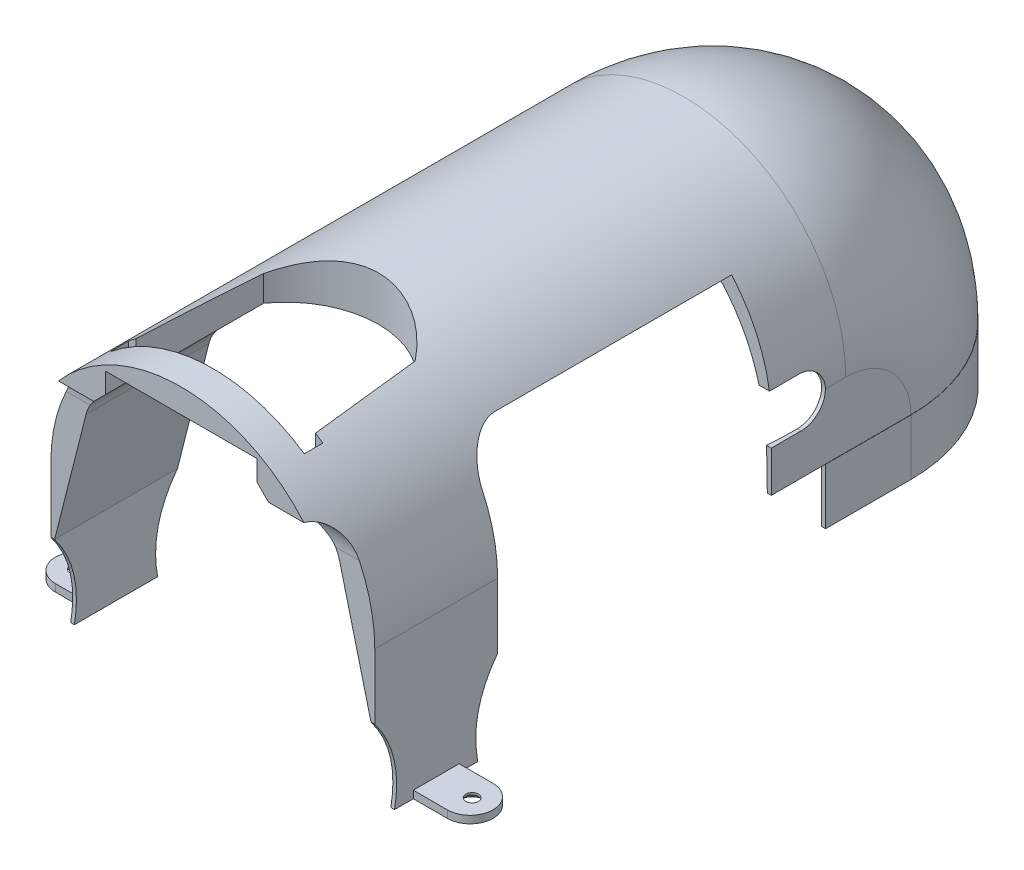
from build123d import *

# Parameters (mm, degrees)
BOSS_EXTRUDE1_DEPTH                                 = 135
CUT_EXTRUDE1_DEPTH                                  = 135
CUT_EXTRUDE2_DEPTH                                  = 121
REVOLVE1_ANGLE                                      = 90
SKETCH8_W                                           = 101.58784839
SKETCH8_H                                           = 201.9517468
CUT_EXTRUDE3_DEPTH                                  = 135
CUT_EXTRUDE4_DEPTH                                  = 64
CUT_EXTRUDE4_DEPTH_BACK                             = 105
CUT_EXTRUDE6_DEPTH                                  = 88
BOSS_EXTRUDE2_DEPTH                                 = 2
CSK_FOR_M3_COUNTERSUNK_FLAT_HEAD_SCREW1_D           = 3.4
CSK_FOR_M3_COUNTERSUNK_FLAT_HEAD_SCREW1_CSINK_D     = 6.3
CSK_FOR_M3_COUNTERSUNK_FLAT_HEAD_SCREW1_CSINK_ANGLE = 90
SKETCH19_W                                          = 40.690948386
SKETCH19_H                                          = 7.539091608
CUT_EXTRUDE7_DEPTH                                  = 77
SKETCH28_W                                          = 94.334032574
SKETCH28_H                                          = 106.25873245
CUT_EXTRUDE10_DEPTH                                 = 79
BOSS_EXTRUDE3_DEPTH                                 = 15


with BuildPart() as part:
    # Sketch1 → Boss-Extrude1 (new body)
    with BuildSketch(Plane.XY):
        with BuildLine():
            Line((43.5, 0), (43.5, -87))
            ThreePointArc((43.5, -87), (0, -130.5), (-43.5, -87))
            Line((-43.5, -87), (-43.5, 0))
            ThreePointArc((-43.5, 0), (0, 43.5), (43.5, 0))
        make_face()
    extrude(amount=BOSS_EXTRUDE1_DEPTH)

    # Sketch2 → Cut-Extrude1 (cut)
    with BuildSketch(Plane(origin=(43.5, 0, 0), x_dir=(0, 0, -1), z_dir=(1, 0, 0))):
        with BuildLine():
            Line((-83.5, 28.5), (-20, 28.5))
            Line((-20, 28.5), (-20, -41.5))
            Line((-20, -41.5), (-93.5, -41.5))
            Line((-93.5, -41.5), (-98.5, -41.5))
            add(Edge.make_bspline(
                [(-93.5, -17.5), (-101.61991507, -28.175965807), (-98.5, -41.5)],
                knots=[0, 0, 0, 1, 1, 1], degree=2))
            Line((-93.5, -17.5), (-93.5, 18.5))
            ThreePointArc((-93.5, 18.5), (-90.571067812, 25.571067812), (-83.5, 28.5))
        make_face()
    cut_extrude1 = extrude(amount=-CUT_EXTRUDE1_DEPTH, mode=Mode.SUBTRACT)

    # Mirror1: Cut-Extrude1 across plane
    add(cut_extrude1.mirror(Plane.XY.offset(110)), mode=Mode.SUBTRACT)

    # Sketch4 → Cut-Extrude2 (cut)
    with BuildSketch(Plane(origin=(43.5, 0, 0), x_dir=(0, 0, -1), z_dir=(1, 0, 0))):
        with BuildLine():
            Line((-20.035680802, 6.5), (-11.959991298, 6.5))
            ThreePointArc((-11.959991298, 6.5), (-5.459991298, 0), (-11.959991298, -6.5))
            Line((-11.959991298, -6.5), (-20.035680802, -6.5))
            ThreePointArc((-20.035680802, -6.5), (-26.535680802, 0), (-20.035680802, 6.5))
        make_face()
    extrude(amount=-CUT_EXTRUDE2_DEPTH, mode=Mode.SUBTRACT)

    # Sketch7 → Revolve1 (revolve)
    with BuildSketch(Plane.XY):
        with BuildLine():
            Line((-43.5, 0), (-43.5, -17.5))
            Line((-43.5, -17.5), (43.5, -17.5))
            Line((43.5, -17.5), (43.5, 0))
            ThreePointArc((43.5, 0), (0, 43.5), (-43.5, 0))
        make_face()
    revolve(axis=Axis((-43.5, -17.5, 0), (-1, 0, 0)), revolution_arc=REVOLVE1_ANGLE)

    # Sketch8 → Cut-Extrude3 (cut)
    with BuildSketch(Plane(origin=(0, -40, 0), x_dir=(1, 0, 0), z_dir=(0, 1, 0))):
        with Locations((0, -41.431269888)):
            Rectangle(SKETCH8_W, SKETCH8_H)
    extrude(amount=-CUT_EXTRUDE3_DEPTH, mode=Mode.SUBTRACT)

    # Sketch9 → Cut-Extrude4 (cut, two sides: drawn at the far end of the back side and taken through both)
    with BuildSketch(Plane.XY.offset(110).offset(-CUT_EXTRUDE4_DEPTH_BACK)):
        with BuildLine():
            Line((-42.5, -40), (-42.5, -17.5))
            Line((-42.5, -17.5), (-34.046451828, 15.832863803))
            ThreePointArc((-34.046451828, 15.832863803), (-33.046939779, 18.31633919), (-31.424384043, 20.445655327))
            Line((-31.424384043, 20.445655327), (-20.345474193, 31.524565177))
            Line((-20.345474193, 31.524565177), (20.345474193, 31.524565177))
            Line((20.345474193, 31.524565177), (31.424384043, 20.445655327))
            ThreePointArc((31.424384043, 20.445655327), (33.046939779, 18.31633919), (34.046451828, 15.832863803))
            Line((34.046451828, 15.832863803), (42.5, -17.5))
            Line((42.5, -17.5), (42.5, -40))
            Line((42.5, -40), (-42.5, -40))
        make_face()
    extrude(amount=CUT_EXTRUDE4_DEPTH + CUT_EXTRUDE4_DEPTH_BACK, mode=Mode.SUBTRACT)

    # Sketch12 → Cut-Revolve3 (revolve, cut)
    with BuildSketch(Plane.XY):
        with BuildLine():
            Line((-42.5, 0), (-42.5, -17.5))
            Line((-42.5, -17.5), (42.5, -17.5))
            Line((42.5, -17.5), (42.5, 0))
            ThreePointArc((42.5, 0), (0, 42.5), (-42.5, 0))
        make_face()
    revolve(axis=Axis((42.5, -17.5, 0), (-1, 0, 0)), mode=Mode.SUBTRACT)

    # Sketch13 → Cut-Extrude6 (cut)
    with BuildSketch(Plane(origin=(0, 0, 0), x_dir=(1, 0, 0), z_dir=(0, 1, 0))):
        with BuildLine():
            Line((-27.655277923, -126.460908392), (24.528084903, -126.460908392))
            Line((24.528084903, -126.460908392), (24.528084903, -121.460908392))
            Line((24.528084903, -121.460908392), (22.528084903, -121.460908392))
            Line((22.528084903, -121.460908392), (20.37003937, -92.531181578))
            ThreePointArc((20.37003937, -92.531181578), (0, -81.974763068), (-20.37003937, -92.531181578))
            Line((-20.37003937, -92.531181578), (-25.655277923, -121.460908392))
            Line((-25.655277923, -121.460908392), (-27.655277923, -121.460908392))
            Line((-27.655277923, -121.460908392), (-27.655277923, -126.460908392))
        make_face()
    extrude(amount=CUT_EXTRUDE6_DEPTH, mode=Mode.SUBTRACT)

    # Sketch14 → Boss-Extrude2 (add)
    with BuildSketch(Plane(origin=(0, -40, 0), x_dir=(1, 0, 0), z_dir=(0, 1, 0))):
        with BuildLine():
            Line((-43.5, -103.852718899), (-52.629849166, -103.852718899))
            ThreePointArc((-52.629849166, -103.852718899), (-58.777130267, -110), (-52.629849166, -116.147281101))
            Line((-52.629849166, -116.147281101), (-43.5, -116.147281101))
            Line((-43.5, -116.147281101), (-43.5, -103.852718899))
        make_face()
    boss_extrude2 = extrude(amount=BOSS_EXTRUDE2_DEPTH)

    # CSK for M3 Countersunk Flat Head Screw1 (through all)
    with Locations(Plane(origin=(-53.159192416, -40, 109.995951554), x_dir=(0, 0, -1), z_dir=(0, -1, 0))):
        with Locations((0, 0)):
            csk_for_m3_countersunk_flat_head_screw1 = CounterSinkHole(CSK_FOR_M3_COUNTERSUNK_FLAT_HEAD_SCREW1_D / 2, CSK_FOR_M3_COUNTERSUNK_FLAT_HEAD_SCREW1_CSINK_D / 2, counter_sink_angle=CSK_FOR_M3_COUNTERSUNK_FLAT_HEAD_SCREW1_CSINK_ANGLE)

    # Sketch19 → Cut-Extrude7 (cut)
    with BuildSketch(Plane(origin=(0, -40, 0), x_dir=(1, 0, 0), z_dir=(0, 1, 0))):
        with Locations((0, -131.230454196)):
            Rectangle(SKETCH19_W, SKETCH19_H)
    extrude(amount=CUT_EXTRUDE7_DEPTH, mode=Mode.SUBTRACT)

    # Mirror2: Boss-Extrude2, CSK for M3 Countersunk Flat Head Screw1 across plane
    add(boss_extrude2.mirror(Plane(origin=(0, 0, 0), x_dir=(0, 0, 1), z_dir=(1, 0, 0))))
    add(csk_for_m3_countersunk_flat_head_screw1.mirror(Plane(origin=(0, 0, 0), x_dir=(0, 0, 1), z_dir=(1, 0, 0))), mode=Mode.SUBTRACT)

    # Sketch28 → Cut-Extrude10 (cut)
    with BuildSketch(Plane(origin=(0, -17.5, 0), x_dir=(-1, 0, 0), z_dir=(0, -1, 0))):
        Rectangle(SKETCH28_W, SKETCH28_H)
    extrude(amount=CUT_EXTRUDE10_DEPTH, mode=Mode.SUBTRACT)

    # Sketch29 → Boss-Extrude3 (add)
    with BuildSketch(Plane(origin=(0, -17.5, 0), x_dir=(-1, 0, 0), z_dir=(0, -1, 0))):
        with BuildLine():
            Line((42.472860291, 17.5), (42.472860291, -5.459991298))
            Line((42.472860291, -5.459991298), (43.5, -5.459991298))
            Line((43.5, -5.459991298), (43.556710092, 17.5))
            ThreePointArc((43.556710092, 17.5), (0, 61.056710092), (-43.556710092, 17.5))
            Line((-43.556710092, 17.5), (-43.556710092, -5.491116587))
            Line((-43.556710092, -5.491116587), (-43.5, -5.459991298))
            Line((-43.5, -5.459991298), (-42.472860291, -5.459991298))
            Line((-42.472860291, -5.459991298), (-42.472860291, 17.5))
            ThreePointArc((-42.472860291, 17.5), (0, 59.972860291), (42.472860291, 17.5))
        make_face()
    extrude(amount=BOSS_EXTRUDE3_DEPTH)


solid = part.part
